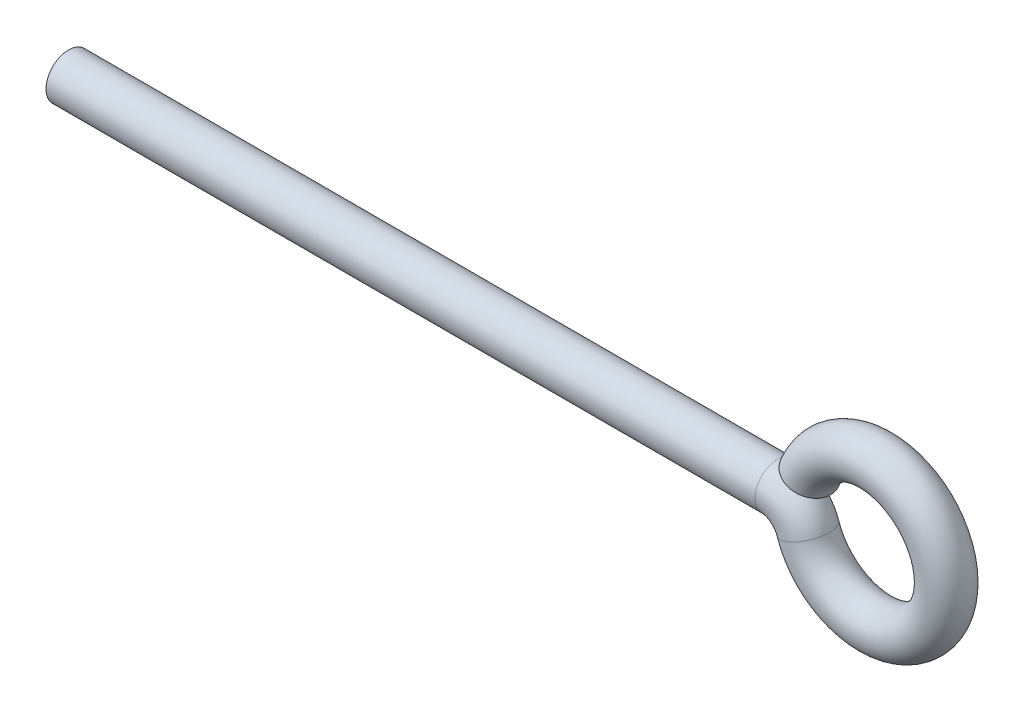
from build123d import *

# Parameters (mm, degrees)
SWEEP2_PROFILE_R = 3.175


with BuildPart() as part:
    # Sweep2: sweep along a path in Sketch1
    with BuildLine(Plane.XY) as sweep2_path:
        Line((0, 0), (100, 0))
        ThreePointArc((100, 0), (102.654618684, -0.860616909), (104.299345667, -3.115064729))
        ThreePointArc((104.299345667, -3.115064729), (123.795693487, -0.349016587), (104.539805378, 3.770373388))
    # Sweep2 profile (on start of the path) → Sweep2 (sweep)
    with BuildSketch(Plane(origin=(0, 0, 0), x_dir=(0, 0, 1), z_dir=(1, 0, 0))):
        Circle(SWEEP2_PROFILE_R)
    sweep(path=sweep2_path.line)


solid = part.part
